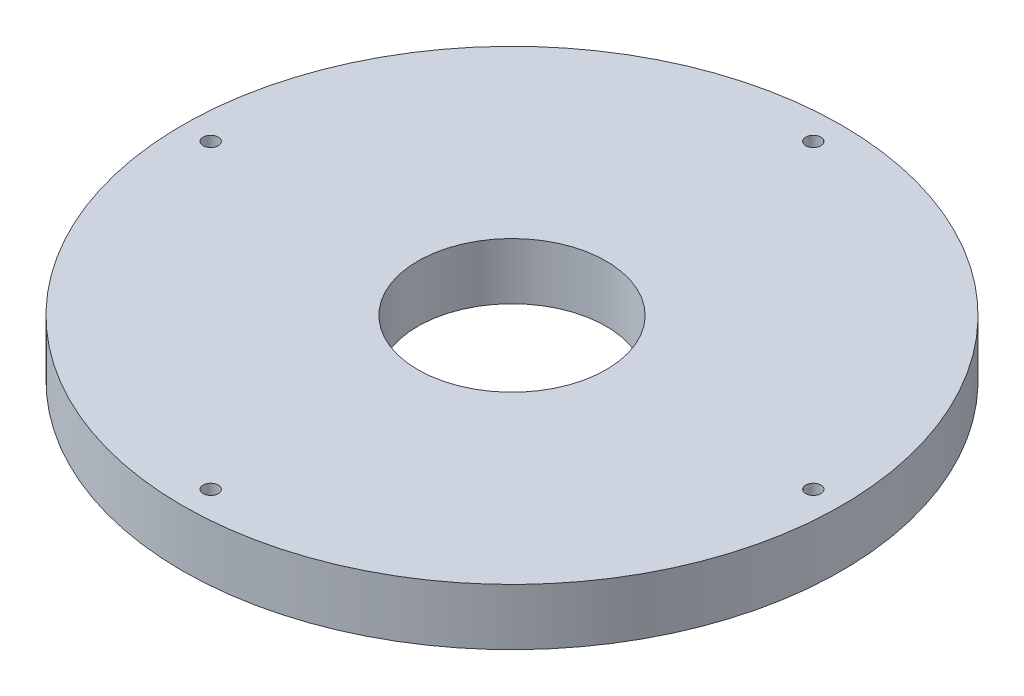
from build123d import *

# Parameters (mm, degrees)
SKETCH2_R           = 175
BOSS_EXTRUDE1_DEPTH = 15
SKETCH3_R           = 4
SKETCH3_R_2         = 50
CUT_EXTRUDE1_DEPTH  = 30


with BuildPart() as part:
    # Sketch2 → Boss-Extrude1 (new, symmetric)
    with BuildSketch(Plane(origin=(0, 0, 0), x_dir=(1, 0, 0), z_dir=(0, 1, 0))):
        with Locations(Location((0, 0, 0), (0, 0, 270))):
            Circle(SKETCH2_R)
    extrude(amount=BOSS_EXTRUDE1_DEPTH, both=True)

    # Sketch3 → Cut-Extrude1 (cut)
    with BuildSketch(Plane(origin=(0, 15, 0), x_dir=(1, 0, 0), z_dir=(0, 1, 0))):
        with Locations(Location((0, 160, 0), (0, 0, 270))):
            Circle(SKETCH3_R)
        with Locations(Location((0, -160, 0), (0, 0, 90))):
            Circle(SKETCH3_R)
        with Locations(Location((-160, 0, 0), (0, 0, 270))):
            Circle(SKETCH3_R)
        with Locations(Location((160, 0, 0), (0, 0, 90))):
            Circle(SKETCH3_R)
        with Locations(Location((0, 0, 0), (0, 0, 270))):
            Circle(SKETCH3_R_2)
    extrude(amount=-CUT_EXTRUDE1_DEPTH, mode=Mode.SUBTRACT)


solid = part.part
